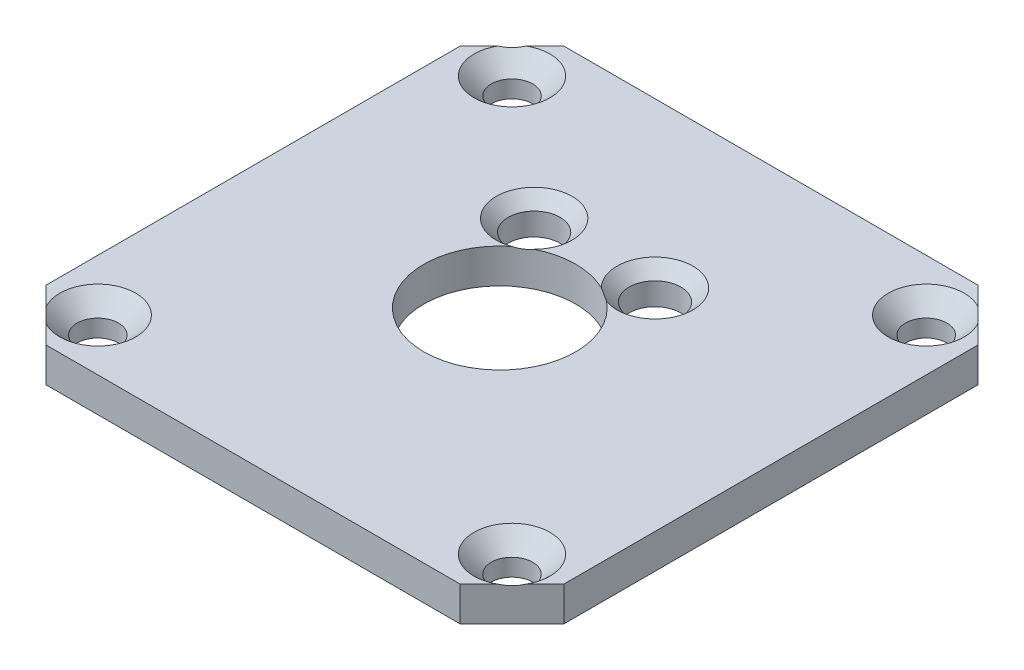
from build123d import *

# Parameters (mm, degrees)
BOSS_EXTRUDE1_DEPTH                             = 2
SKETCH2_R                                       = 4.4
CUT_EXTRUDE1_DEPTH                              = 34.661067402
CUT_EXTRUDE2_REACH                              = 35.661
SKETCH5_R                                       = 1.5
CSK_FOR_M2_FLAT_HEAD_MACHINE_SCREW1_D           = 2.4
CSK_FOR_M2_FLAT_HEAD_MACHINE_SCREW1_DEPTH       = 42.93
CSK_FOR_M2_FLAT_HEAD_MACHINE_SCREW1_CSINK_D     = 4.4
CSK_FOR_M2_FLAT_HEAD_MACHINE_SCREW1_CSINK_ANGLE = 90
CSK_FOR_M2_FLAT_HEAD_MACHINE_SCREW1_TIP         = 0.721032743
CSK_FOR_M2_FLAT_HEAD_MACHINE_SCREW2_D           = 2.4
CSK_FOR_M2_FLAT_HEAD_MACHINE_SCREW2_DEPTH       = 42.93
CSK_FOR_M2_FLAT_HEAD_MACHINE_SCREW2_CSINK_D     = 4.4
CSK_FOR_M2_FLAT_HEAD_MACHINE_SCREW2_CSINK_ANGLE = 90
CSK_FOR_M2_FLAT_HEAD_MACHINE_SCREW2_TIP         = 0.721032743


with BuildPart() as part:
    # Sketch1 → Boss-Extrude1 (new body)
    with BuildSketch(Plane(origin=(0, 0, 0), x_dir=(1, 0, 0), z_dir=(0, 1, 0))):
        Polygon((-11.293051345, 29.704532022), (12.706948655, 29.704532022), (15.706948655, 26.704532022), (15.706948655, 2.704532022), (12.706948655, -0.295467978), (-11.293051345, -0.295467978), (-14.293051345, 2.704532022), (-14.293051345, 26.704532022), align=None)
    extrude(amount=BOSS_EXTRUDE1_DEPTH)

    # Sketch2 → Cut-Extrude1 (cut, through all)
    with BuildSketch(Plane(origin=(0, 2, 0), x_dir=(1, 0, 0), z_dir=(0, 1, 0))):
        with Locations(Location((0, 14.704532022, 0), (0, 0, 270))):
            Circle(SKETCH2_R)
    extrude(amount=-CUT_EXTRUDE1_DEPTH, mode=Mode.SUBTRACT)

    # Sketch5 → Cut-Extrude2 (cut, up to next)
    with BuildSketch(Plane(origin=(0, 2, 0), x_dir=(1, 0, 0), z_dir=(0, 1, 0)), mode=Mode.PRIVATE) as cut_extrude2_sk1:
        with Locations(Location((-3.508440786, 20.204532022, 0), (0, 0, 270))):
            Circle(SKETCH5_R)
    cut_extrude2_tool1 = extrude(cut_extrude2_sk1.sketch, amount=-CUT_EXTRUDE2_REACH, mode=Mode.PRIVATE) & part.part
    # Sketch5 → Cut-Extrude2 (cut, up to next)
    with BuildSketch(Plane(origin=(0, 2, 0), x_dir=(1, 0, 0), z_dir=(0, 1, 0)), mode=Mode.PRIVATE) as cut_extrude2_sk2:
        with Locations(Location((3.491559214, 20.204532022, 0), (0, 0, 270))):
            Circle(SKETCH5_R)
    cut_extrude2_tool2 = extrude(cut_extrude2_sk2.sketch, amount=-CUT_EXTRUDE2_REACH, mode=Mode.PRIVATE) & part.part
    add(cut_extrude2_tool1.solids().sort_by_distance((-3.508441, 2, -20.204532))[0], mode=Mode.SUBTRACT)
    add(cut_extrude2_tool2.solids().sort_by_distance((3.491559, 2, -20.204532))[0], mode=Mode.SUBTRACT)

    # CSK for M2 Flat Head Machine Screw1
    with Locations(Plane(origin=(-3.508440786, 2, -20.204532022), x_dir=(0, 0, 1), z_dir=(0, 1, 0))):
        with Locations((0, 0), (0, 7)):
            CounterSinkHole(CSK_FOR_M2_FLAT_HEAD_MACHINE_SCREW1_D / 2, CSK_FOR_M2_FLAT_HEAD_MACHINE_SCREW1_CSINK_D / 2, depth=CSK_FOR_M2_FLAT_HEAD_MACHINE_SCREW1_DEPTH, counter_sink_angle=CSK_FOR_M2_FLAT_HEAD_MACHINE_SCREW1_CSINK_ANGLE)
            with Locations((0, 0, -(CSK_FOR_M2_FLAT_HEAD_MACHINE_SCREW1_DEPTH + CSK_FOR_M2_FLAT_HEAD_MACHINE_SCREW1_TIP / 2))):  # 118° drill point
                Cone(0, CSK_FOR_M2_FLAT_HEAD_MACHINE_SCREW1_D / 2, CSK_FOR_M2_FLAT_HEAD_MACHINE_SCREW1_TIP, mode=Mode.SUBTRACT)

    # CSK for M2 Flat Head Machine Screw2
    with Locations(Plane(origin=(0, 2, 0), x_dir=(1, 0, 0), z_dir=(0, 1, 0))):
        with Locations((-11.293051345, 26.704532022), (-11.293051345, 2.704532022), (12.706948655, 26.704532022), (12.706948655, 2.704532022)):
            CounterSinkHole(CSK_FOR_M2_FLAT_HEAD_MACHINE_SCREW2_D / 2, CSK_FOR_M2_FLAT_HEAD_MACHINE_SCREW2_CSINK_D / 2, depth=CSK_FOR_M2_FLAT_HEAD_MACHINE_SCREW2_DEPTH, counter_sink_angle=CSK_FOR_M2_FLAT_HEAD_MACHINE_SCREW2_CSINK_ANGLE)
            with Locations((0, 0, -(CSK_FOR_M2_FLAT_HEAD_MACHINE_SCREW2_DEPTH + CSK_FOR_M2_FLAT_HEAD_MACHINE_SCREW2_TIP / 2))):  # 118° drill point
                Cone(0, CSK_FOR_M2_FLAT_HEAD_MACHINE_SCREW2_D / 2, CSK_FOR_M2_FLAT_HEAD_MACHINE_SCREW2_TIP, mode=Mode.SUBTRACT)


solid = part.part
